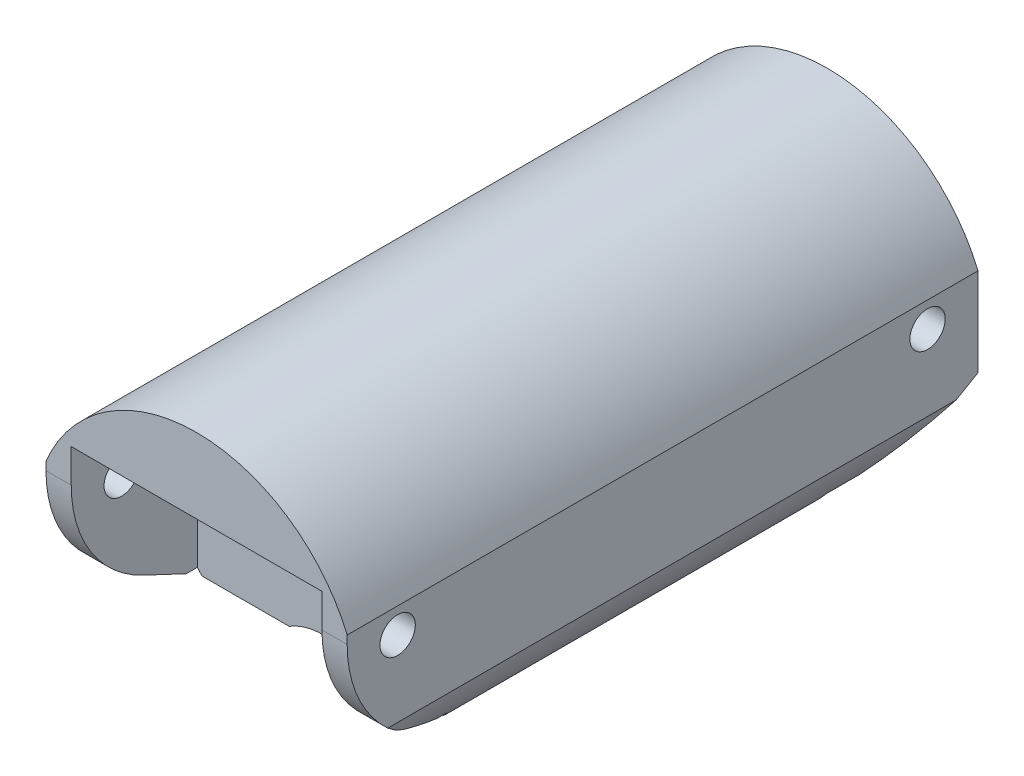
from build123d import *

# Parameters (mm, degrees)
BOSS_EXTRUDE1_DEPTH = 15.875
CUT_EXTRUDE1_DEPTH  = 25.170309552
CUT_EXTRUDE2_DEPTH  = 37.609435107
BOSS_EXTRUDE2_DEPTH = 15.15872
SKETCH6_W           = 12.61872
SKETCH6_H           = 6.35
CUT_EXTRUDE3_DEPTH  = 11.43
SKETCH7_R           = 0.889
CUT_EXTRUDE4_DEPTH  = 25.170309552
CUT_EXTRUDE5_DEPTH  = 15.875
FILLET1_R           = 6.35
CUT_EXTRUDE6_DEPTH  = 17.78
SKETCH10_W          = 0.284935898
SKETCH10_H          = 2.320192308
CUT_EXTRUDE7_DEPTH  = 1


with BuildPart() as part:
    # Sketch1 → Boss-Extrude1 (new, symmetric)
    with BuildSketch(Plane.XY):
        with BuildLine():
            Line((0, 0), (0, 5.08))
            ThreePointArc((0, 5.08), (7.57936, 10.11936), (15.15872, 5.08))
            Line((15.15872, 5.08), (15.15872, 0))
            ThreePointArc((15.15872, 0), (7.57936, -5.03936), (0, 0))
        make_face()
    extrude(amount=BOSS_EXTRUDE1_DEPTH, both=True)

    # Sketch2 → Cut-Extrude1 (cut, through all)
    with BuildSketch(Plane(origin=(0, 0, 0), x_dir=(0, 0, -1), z_dir=(1, 0, 0))):
        Polygon((-15.875, -5.03936), (-15.875, 0.635), (-3.81, -5.03936), align=None)
        Polygon((15.875, 0.635), (15.875, -5.03936), (6.04672018, -5.03936), align=None)
        with BuildLine():
            Line((-13.335, 1.27), (-15.875, 1.27))
            Line((-15.875, 1.27), (-15.875, 3.81))
            Line((-15.875, 3.81), (-13.335, 3.81))
            ThreePointArc((-13.335, 3.81), (-8.595295474, 2.54), (-13.335, 1.27))
        make_face()
        with BuildLine():
            Line((13.335, 1.27), (15.875, 1.27))
            Line((15.875, 1.27), (15.875, 3.81))
            Line((15.875, 3.81), (13.335, 3.81))
            ThreePointArc((13.335, 3.81), (8.595295474, 2.54), (13.335, 1.27))
        make_face()
    extrude(amount=CUT_EXTRUDE1_DEPTH, mode=Mode.SUBTRACT)

    # Sketch3 → Cut-Extrude2 (cut, through all)
    with BuildSketch(Plane.XY.offset(15.875)):
        with BuildLine():
            ThreePointArc((4.953709685, -3.254259045), (7.57936, -3.76936), (10.205010315, -3.254259045))
            ThreePointArc((10.205010315, -3.254259045), (7.57936, -1.86436), (4.953709685, -3.254259045))
        make_face()
    extrude(amount=-CUT_EXTRUDE2_DEPTH, mode=Mode.SUBTRACT)

    # Sketch4 → Boss-Extrude2 (add)
    with BuildSketch(Plane.ZY):
        with BuildLine():
            Line((15.875, 1.27), (13.335, 1.27))
            ThreePointArc((13.335, 1.27), (12.405295474, 0.340295474), (11.135295474, 0))
            ThreePointArc((11.135295474, 0), (8.595295474, 2.54), (11.135295474, 5.08))
            ThreePointArc((11.135295474, 5.08), (12.405295474, 4.739704526), (13.335, 3.81))
            Line((13.335, 3.81), (15.875, 3.81))
            Line((15.875, 3.81), (15.875, 1.27))
        make_face()
        with BuildLine():
            Line((-13.335, 1.27), (-15.875, 1.27))
            Line((-15.875, 1.27), (-15.875, 3.81))
            Line((-15.875, 3.81), (-13.335, 3.81))
            ThreePointArc((-13.335, 3.81), (-12.405295474, 4.739704526), (-11.135295474, 5.08))
            ThreePointArc((-11.135295474, 5.08), (-8.595295474, 2.54), (-11.135295474, 0))
            ThreePointArc((-11.135295474, 0), (-12.405295474, 0.340295474), (-13.335, 1.27))
        make_face()
    extrude(amount=-BOSS_EXTRUDE2_DEPTH)

    # Sketch6 → Cut-Extrude3 (cut)
    with BuildSketch(Plane(origin=(0, -5.08, 0), x_dir=(1, 0, 0), z_dir=(0, 1, 0))):
        with Locations((7.57936, -12.7)):
            Rectangle(SKETCH6_W, SKETCH6_H)
        with Locations((7.57936, 12.7)):
            Rectangle(SKETCH6_W, SKETCH6_H)
    extrude(amount=CUT_EXTRUDE3_DEPTH, mode=Mode.SUBTRACT)

    # Sketch7 → Cut-Extrude4 (cut, through all)
    with BuildSketch(Plane.ZY):
        with Locations((13.335, 3.81)):
            Circle(SKETCH7_R)
        with Locations(Location((-13.335, 3.81, 0), (0, 0, 180))):
            Circle(SKETCH7_R)
    extrude(amount=-CUT_EXTRUDE4_DEPTH, mode=Mode.SUBTRACT)

    # Sketch8 → Cut-Extrude5 (cut)
    with BuildSketch(Plane(origin=(0, 0, -9.525), x_dir=(-1, 0, 0), z_dir=(0, 0, -1))):
        with BuildLine():
            Line((-4.91236, 6.23824), (-5.54736, 6.23824))
            ThreePointArc((-5.54736, 6.23824), (-5.92836, 5.85724), (-5.54736, 5.47624))
            Line((-5.54736, 5.47624), (-4.91236, 5.47624))
            ThreePointArc((-4.91236, 5.47624), (-4.53136, 5.85724), (-4.91236, 6.23824))
        make_face()
    extrude(amount=-CUT_EXTRUDE5_DEPTH, mode=Mode.SUBTRACT)

    # Fillet1
    fillet1_edges = [part.edges().sort_by_distance(p)[0] for p in [
        (0.635, 0.635, 15.875),
        (14.52372, 0.635, 15.875),
    ]]
    fillet(fillet1_edges, radius=FILLET1_R)

    # Sketch9 → Cut-Extrude6 (cut)
    with BuildSketch(Plane.XY.offset(9.525)):
        with BuildLine():
            Line((9.61136, 6.767094737), (10.24636, 6.767094737))
            ThreePointArc((10.24636, 6.767094737), (10.62736, 6.386094737), (10.24636, 6.005094737))
            Line((10.24636, 6.005094737), (9.61136, 6.005094737))
            ThreePointArc((9.61136, 6.005094737), (9.23036, 6.386094737), (9.61136, 6.767094737))
        make_face()
    extrude(amount=-CUT_EXTRUDE6_DEPTH, mode=Mode.SUBTRACT)

    # Sketch10 → Cut-Extrude7 (cut)
    # profile 1 of 9: a face of its own
    with BuildSketch(Plane.ZY):
        with BuildLine():
            Line((-9.132963094, 3.918079484), (-8.510301836, 3.918079484))
            add(Edge.make_bspline(
                [(-8.510301836, 3.918079484), (-8.4674748, 3.918032407), (-8.385416296, 3.917942204), (-8.26774621, 3.915207399), (-8.160875953, 3.911554614), (-8.065035965, 3.90649104), (-7.979931362, 3.90050699), (-7.90594724, 3.892114069), (-7.842502071, 3.883350801), (-7.804486935, 3.874441382), (-7.787149793, 3.870378162)],
                knots=[0, 0, 0, 0, 1.415646017, 2.712440637, 3.8905458, 4.950247383, 5.884950622, 6.709939814, 7.411656543, 8, 8, 8, 8], degree=3))
            add(Edge.make_bspline(
                [(-7.787149793, 3.870378162), (-7.765202801, 3.864371107), (-7.721825972, 3.852498547), (-7.659322883, 3.828718955), (-7.59985618, 3.800522991), (-7.543221838, 3.768388417), (-7.490115805, 3.730936512), (-7.439745754, 3.689685445), (-7.3925562, 3.643682808), (-7.348812509, 3.593444565), (-7.308639871, 3.539814089), (-7.274050802, 3.48199078), (-7.245088246, 3.420947955), (-7.220247707, 3.356728073), (-7.202369323, 3.288791851), (-7.188901064, 3.217611333), (-7.180352488, 3.14319415), (-7.179533735, 3.092339841), (-7.17911694, 3.06645188)],
                knots=[0, 0, 0, 0, 0.999701418, 1.975846123, 2.934577507, 3.890451536, 4.834027766, 5.787354733, 6.749476667, 7.726910423, 8.712836071, 9.690891519, 10.682875813, 11.679750201, 12.712814741, 13.765529915, 14.8625177, 16, 16, 16, 16], degree=3))
            add(Edge.make_bspline(
                [(-7.17911694, 3.06645188), (-7.179499233, 3.040346325), (-7.180247213, 2.989269044), (-7.189224558, 2.914545158), (-7.201316946, 2.843136333), (-7.219910701, 2.775200902), (-7.244263561, 2.711142311), (-7.272831352, 2.649981622), (-7.30728784, 2.592759348), (-7.346879936, 2.539267748), (-7.390923168, 2.489456614), (-7.43923119, 2.443686907), (-7.491608977, 2.402226543), (-7.547890069, 2.364982574), (-7.608623146, 2.332818663), (-7.672887099, 2.304010251), (-7.74124051, 2.279815789), (-7.788541219, 2.267088519), (-7.812590498, 2.260617545)],
                knots=[0, 0, 0, 0, 1.121902311, 2.195077645, 3.232258892, 4.234102512, 5.217864754, 6.176164875, 7.132989551, 8.084763148, 9.034132444, 9.988522005, 10.94243251, 11.903244335, 12.886203696, 13.894208494, 14.929344452, 16, 16, 16, 16], degree=3))
            add(Edge.make_bspline(
                [(-7.812590498, 2.260617545), (-7.832481722, 2.256387555), (-7.876074497, 2.247117286), (-7.947868252, 2.236768186), (-8.031457281, 2.227934791), (-8.126727492, 2.221311616), (-8.23359337, 2.215641639), (-8.352112725, 2.211134868), (-8.482518209, 2.208658501), (-8.573478552, 2.208530781), (-8.620968903, 2.208464099)],
                knots=[0, 0, 0, 0, 0.601384939, 1.31797006, 2.144135048, 3.087295005, 4.142315834, 5.309527816, 6.595305764, 8, 8, 8, 8], degree=3))
            Line((-8.620968903, 2.208464099), (-8.848027196, 2.208464099))
            Line((-8.848027196, 2.208464099), (-8.848027196, 0.743079484))
            Line((-8.848027196, 0.743079484), (-9.132963094, 0.743079484))
            Line((-9.132963094, 0.743079484), (-9.132963094, 3.918079484))
        make_face()
        with BuildLine():
            Line((-8.848027196, 3.592438458), (-8.848027196, 2.534105125))
            Line((-8.848027196, 2.534105125), (-8.292147789, 2.527108931))
            add(Edge.make_bspline(
                [(-8.292147789, 2.527108931), (-8.265006142, 2.527094903), (-8.212609753, 2.527067823), (-8.136921179, 2.53068299), (-8.066699897, 2.534856331), (-8.002161603, 2.540966775), (-7.943277205, 2.549603916), (-7.889948519, 2.558323136), (-7.842589055, 2.570937286), (-7.78716335, 2.587921784), (-7.725402028, 2.616889229), (-7.65821218, 2.6589352), (-7.601270291, 2.712529843), (-7.551995836, 2.772789375), (-7.512892647, 2.839826443), (-7.484266854, 2.911553264), (-7.467447376, 2.987234242), (-7.465192043, 3.039021339), (-7.464052838, 3.065179845)],
                knots=[0, 0, 0, 0, 1.160613943, 2.240541288, 3.23993089, 4.169200891, 5.011653406, 5.7853311, 6.478053781, 7.106038997, 8.262395093, 9.384106736, 10.481365981, 11.59014053, 12.70357646, 13.786202915, 14.881775077, 16, 16, 16, 16], degree=3))
            add(Edge.make_bspline(
                [(-7.464052838, 3.065179845), (-7.465198238, 3.090705496), (-7.467475153, 3.141447332), (-7.484398686, 3.215813779), (-7.512836992, 3.28678474), (-7.552258332, 3.352981753), (-7.600102071, 3.413024453), (-7.655709332, 3.465182562), (-7.718949219, 3.507112249), (-7.777775829, 3.534175297), (-7.830028333, 3.550699154), (-7.875414468, 3.562260545), (-7.92665958, 3.571491274), (-7.983780352, 3.57896568), (-8.046334051, 3.585364177), (-8.114858094, 3.589705742), (-8.189092899, 3.592247063), (-8.240628202, 3.592373115), (-8.267343102, 3.592438458)],
                knots=[0, 0, 0, 0, 1.120700087, 2.227813068, 3.331159281, 4.466773991, 5.599788987, 6.693661531, 7.80175334, 8.91857717, 9.525282508, 10.207424825, 10.974604443, 11.810962634, 12.737642355, 13.736264703, 14.826523623, 16, 16, 16, 16], degree=3))
            Line((-8.267343102, 3.592438458), (-8.848027196, 3.592438458))
        make_face(mode=Mode.SUBTRACT)
    # profile 2 of 9: a face of its own
    with BuildSketch(Plane.ZY):
        with BuildLine():
            add(Edge.make_bspline(
                [(-5.488582084, 3.10397692), (-5.445047144, 3.103049919), (-5.359685765, 3.101232296), (-5.234674326, 3.081805863), (-5.115344095, 3.052099325), (-5.00123805, 3.011031551), (-4.893817553, 2.955984353), (-4.791517925, 2.890298782), (-4.694619638, 2.812481714), (-4.636541604, 2.752285467), (-4.607061652, 2.721730325)],
                knots=[0, 0, 0, 0, 1.054011418, 2.066658804, 3.057071809, 4.030435133, 4.997543892, 5.974964718, 6.972108034, 8, 8, 8, 8], degree=3))
            add(Edge.make_bspline(
                [(-4.607061652, 2.721730325), (-4.581678022, 2.692507638), (-4.531402005, 2.634627803), (-4.466935246, 2.540778783), (-4.411398545, 2.443587406), (-4.366891431, 2.341763046), (-4.331798588, 2.236194594), (-4.306883278, 2.126519198), (-4.292063344, 2.012979069), (-4.290064938, 1.935868444), (-4.289052838, 1.896815462)],
                knots=[0, 0, 0, 0, 1.025258237, 2.030674902, 3.01204498, 3.988269485, 4.97094183, 5.956517959, 6.965070386, 8, 8, 8, 8], degree=3))
            add(Edge.make_bspline(
                [(-4.289052838, 1.896815462), (-4.289943051, 1.857536124), (-4.291702153, 1.77991832), (-4.308342434, 1.665600752), (-4.334224205, 1.554752592), (-4.371264515, 1.447837919), (-4.4187608, 1.344529926), (-4.476718781, 1.245279835), (-4.545545176, 1.149891828), (-4.623563088, 1.059175875), (-4.709788718, 0.975567952), (-4.803329795, 0.902698736), (-4.902348098, 0.840267781), (-5.008160282, 0.789979033), (-5.119800074, 0.75032809), (-5.237508271, 0.72247879), (-5.361102014, 0.705640691), (-5.445490993, 0.70347845), (-5.488582084, 0.702374356)],
                knots=[0, 0, 0, 0, 0.998656419, 1.973391657, 2.932242238, 3.890759089, 4.846373663, 5.82037756, 6.809684879, 7.83454468, 8.860553229, 9.859544525, 10.845671541, 11.83227036, 12.833544569, 13.85385346, 14.904124723, 16, 16, 16, 16], degree=3))
            add(Edge.make_bspline(
                [(-5.488582084, 0.702374356), (-5.531884294, 0.703482155), (-5.61669386, 0.705651836), (-5.740723858, 0.722413371), (-5.858643012, 0.750315256), (-5.970428955, 0.790109338), (-6.076696066, 0.840269389), (-6.176288103, 0.902509993), (-6.269905169, 0.975589562), (-6.35614904, 1.059170019), (-6.434162061, 1.149893337), (-6.502989719, 1.245279443), (-6.560947372, 1.344530028), (-6.608443742, 1.447837892), (-6.64548403, 1.554752599), (-6.671365807, 1.66560075), (-6.688006085, 1.77991832), (-6.689765188, 1.857536124), (-6.690655402, 1.896815462)],
                knots=[0, 0, 0, 0, 1.099876186, 2.154163076, 3.173186993, 4.173200201, 5.163417411, 6.152872554, 7.150605724, 8.17532212, 9.198891216, 10.186952605, 11.159729845, 12.11414092, 13.071450619, 14.029093627, 15.002601286, 16, 16, 16, 16], degree=3))
            add(Edge.make_bspline(
                [(-6.690655402, 1.896815462), (-6.689636399, 1.935656185), (-6.687618948, 2.012554143), (-6.672813915, 2.125880834), (-6.647995796, 2.235370608), (-6.612860886, 2.340531576), (-6.567943534, 2.441909721), (-6.513187223, 2.539341247), (-6.448062863, 2.632765894), (-6.397986807, 2.690570924), (-6.372646588, 2.719822272)],
                knots=[0, 0, 0, 0, 1.031353054, 2.041901799, 3.029428768, 4.008703097, 4.981709435, 5.96992636, 6.972712378, 8, 8, 8, 8], degree=3))
            add(Edge.make_bspline(
                [(-6.372646588, 2.719822272), (-6.34321108, 2.750642396), (-6.285320975, 2.811255592), (-6.187940343, 2.88884581), (-6.085892377, 2.955898248), (-5.977284765, 3.009851672), (-5.863272459, 3.052340899), (-5.743330717, 3.081882474), (-5.617895071, 3.101162303), (-5.532115986, 3.103029364), (-5.488582084, 3.10397692)],
                knots=[0, 0, 0, 0, 1.027980169, 2.021703884, 2.998553061, 3.971491411, 4.943284454, 5.930300938, 6.949603206, 8, 8, 8, 8], degree=3))
        make_face()
        with BuildLine():
            add(Edge.make_bspline(
                [(-5.48985412, 2.819041022), (-5.520640381, 2.818166), (-5.581418162, 2.816438544), (-5.670880214, 2.803299573), (-5.757004497, 2.782482909), (-5.839954405, 2.752906372), (-5.919450212, 2.714716656), (-5.995568027, 2.667809787), (-6.06853174, 2.612807033), (-6.13691404, 2.549794467), (-6.199672281, 2.480961379), (-6.254534445, 2.407620368), (-6.301184363, 2.330961039), (-6.340046507, 2.250903676), (-6.368990885, 2.166636987), (-6.390012127, 2.079115271), (-6.403138702, 1.988160215), (-6.404849917, 1.926328434), (-6.405719504, 1.894907409)],
                knots=[0, 0, 0, 0, 1.021534396, 2.016698045, 2.994645724, 3.958388632, 4.93408049, 5.916473867, 6.921342795, 7.962252576, 8.998418191, 10.008913653, 10.997312074, 11.973003931, 12.956656626, 13.948281152, 14.957379055, 16, 16, 16, 16], degree=3))
            add(Edge.make_bspline(
                [(-6.405719504, 1.894907409), (-6.404261886, 1.854310927), (-6.401368785, 1.773734502), (-6.377841821, 1.655070126), (-6.338484267, 1.541149446), (-6.285337235, 1.432640296), (-6.218747308, 1.332244729), (-6.140291183, 1.242735597), (-6.050810883, 1.165459897), (-5.951373058, 1.101342273), (-5.844008784, 1.050397351), (-5.730383407, 1.014293995), (-5.611873635, 0.990824674), (-5.530883257, 0.988491979), (-5.48985412, 0.987310253)],
                knots=[0, 0, 0, 0, 1.016792936, 2.018143844, 3.017858371, 4.030088057, 5.03801393, 6.028138512, 7.003788237, 7.991172063, 8.984598303, 9.972568034, 10.972917682, 12, 12, 12, 12], degree=3))
            add(Edge.make_bspline(
                [(-5.48985412, 0.987310253), (-5.448827342, 0.988498865), (-5.367841623, 0.99084515), (-5.249496512, 1.014175794), (-5.136181695, 1.050555543), (-5.028928936, 1.101284977), (-4.929536375, 1.165703381), (-4.839412529, 1.242299238), (-4.761626289, 1.332481803), (-4.695102233, 1.432773276), (-4.641084831, 1.540981224), (-4.601911498, 1.655091152), (-4.578327973, 1.773729147), (-4.575442507, 1.854309133), (-4.573988735, 1.894907409)],
                knots=[0, 0, 0, 0, 1.02726834, 2.027799167, 3.010890988, 4.004497153, 4.992059811, 5.971914811, 6.958719428, 7.966827853, 8.981595046, 9.981490638, 10.983022906, 12, 12, 12, 12], degree=3))
            add(Edge.make_bspline(
                [(-4.573988735, 1.894907409), (-4.574858023, 1.926328622), (-4.576568648, 1.988160772), (-4.589699509, 2.079113141), (-4.610704891, 2.166644803), (-4.639707716, 2.250874835), (-4.678401, 2.331168321), (-4.725950519, 2.407395288), (-4.780588664, 2.48121544), (-4.844104195, 2.549571957), (-4.912415116, 2.612831598), (-4.985408401, 2.667831115), (-5.061413345, 2.714510505), (-5.140678203, 2.753233023), (-5.223638746, 2.782213825), (-5.309642356, 2.803419769), (-5.398722705, 2.816383019), (-5.459282694, 2.818149355), (-5.48985412, 2.819041022)],
                knots=[0, 0, 0, 0, 1.042956736, 2.052379634, 3.044323526, 4.02829302, 5.004299113, 5.996692471, 7.007513377, 8.048758398, 9.090003419, 10.095195979, 11.07790575, 12.047570684, 13.018257071, 13.989683339, 14.985167495, 16, 16, 16, 16], degree=3))
        make_face(mode=Mode.SUBTRACT)
    # profile 3 of 9: a face of its own
    with BuildSketch(Plane.ZY):
        with BuildLine():
            add(Edge.make_bspline(
                [(-3.618690257, 4.040194869), (-3.601008849, 4.039374673), (-3.566385257, 4.037768573), (-3.516317078, 4.024014947), (-3.470726789, 4.000701661), (-3.430288417, 3.969423665), (-3.395588491, 3.932639527), (-3.371294561, 3.889767077), (-3.355680459, 3.843449598), (-3.353794912, 3.811141624), (-3.352834889, 3.794692064)],
                knots=[0, 0, 0, 0, 1.055194115, 2.066272739, 3.074728998, 4.095836921, 5.109056067, 6.073838105, 7.019297344, 8, 8, 8, 8], degree=3))
            add(Edge.make_bspline(
                [(-3.352834889, 3.794692064), (-3.353816562, 3.778669514), (-3.355757215, 3.74699483), (-3.371282501, 3.701480323), (-3.395795531, 3.65920358), (-3.430266166, 3.622490865), (-3.470732685, 3.591230159), (-3.516315512, 3.567912289), (-3.566385669, 3.554159879), (-3.601008989, 3.552553611), (-3.618690257, 3.55173333)],
                knots=[0, 0, 0, 0, 0.96129708, 1.900370562, 2.859976407, 3.87933698, 4.906634145, 5.921202961, 6.938410037, 8, 8, 8, 8], degree=3))
            add(Edge.make_bspline(
                [(-3.618690257, 3.55173333), (-3.636169336, 3.552522291), (-3.670190078, 3.554057899), (-3.71950857, 3.56818213), (-3.764710129, 3.591238139), (-3.805227367, 3.622286178), (-3.839000471, 3.659429049), (-3.863582523, 3.701454523), (-3.879071953, 3.747001399), (-3.881017438, 3.778671721), (-3.882001555, 3.794692064)],
                knots=[0, 0, 0, 0, 1.054934014, 2.053291228, 3.073705704, 4.106921865, 5.123545215, 6.088680038, 7.033164197, 8, 8, 8, 8], degree=3))
            add(Edge.make_bspline(
                [(-3.882001555, 3.794692064), (-3.881038998, 3.811139335), (-3.879148475, 3.843442812), (-3.863570913, 3.889793306), (-3.83920523, 3.93241224), (-3.805205005, 3.969628229), (-3.76471608, 4.00069373), (-3.719507033, 4.023745121), (-3.670190484, 4.03787055), (-3.636169473, 4.039405993), (-3.618690257, 4.040194869)],
                knots=[0, 0, 0, 0, 0.98631895, 1.937192651, 2.907499808, 3.917963147, 4.944918757, 5.95915025, 6.951458133, 8, 8, 8, 8], degree=3))
        make_face()
    # profile 4 of 9: a face of its own
    with BuildSketch(Plane.ZY):
        with Locations((-3.617418222, 1.903175638)):
            Rectangle(SKETCH10_W, SKETCH10_H)
    # profile 5 of 9: a face of its own
    with BuildSketch(Plane.ZY):
        with BuildLine():
            Line((-2.782963094, 3.063271792), (-2.498027196, 3.063271792))
            Line((-2.498027196, 3.063271792), (-2.498027196, 2.644772192))
            add(Edge.make_bspline(
                [(-2.498027196, 2.644772192), (-2.46760377, 2.682729519), (-2.40856605, 2.756387037), (-2.310245977, 2.853197844), (-2.206338296, 2.932976727), (-2.097479335, 2.996570883), (-1.983521319, 3.044510322), (-1.865158888, 3.079132274), (-1.741683405, 3.099892083), (-1.657714237, 3.102604649), (-1.615234729, 3.10397692)],
                knots=[0, 0, 0, 0, 1.12780773, 2.188550248, 3.19190651, 4.159438251, 5.104880172, 6.052711206, 7.014878035, 8, 8, 8, 8], degree=3))
            add(Edge.make_bspline(
                [(-1.615234729, 3.10397692), (-1.572299082, 3.102393778), (-1.488263665, 3.099295188), (-1.365909995, 3.07478719), (-1.25163413, 3.032926851), (-1.145843533, 2.975584473), (-1.050478133, 2.904277172), (-0.966726303, 2.821203042), (-0.897453929, 2.725648166), (-0.851010607, 2.636999303), (-0.820416626, 2.558360183), (-0.801155863, 2.491007774), (-0.784799187, 2.415970594), (-0.770618958, 2.333475395), (-0.761024007, 2.24294418), (-0.753456357, 2.144748059), (-0.748032827, 2.03891884), (-0.747817646, 1.965724543), (-0.747706684, 1.927980325)],
                knots=[0, 0, 0, 0, 1.235846778, 2.418850247, 3.575807741, 4.728682307, 5.871620074, 6.994088408, 8.11269785, 9.256955736, 9.865816715, 10.540099792, 11.271859618, 12.076849838, 12.949306005, 13.892391288, 14.913166135, 16, 16, 16, 16], degree=3))
            Line((-0.747706684, 1.927980325), (-0.747706684, 0.743079484))
            Line((-0.747706684, 0.743079484), (-1.032642581, 0.743079484))
            Line((-1.032642581, 0.743079484), (-1.032642581, 1.834485734))
            add(Edge.make_bspline(
                [(-1.032642581, 1.834485734), (-1.032817848, 1.866074666), (-1.033153105, 1.926498917), (-1.034210513, 2.013012246), (-1.036759409, 2.091467927), (-1.040341093, 2.161678396), (-1.045583499, 2.223576234), (-1.051046886, 2.277287506), (-1.057727972, 2.32274402), (-1.063681472, 2.350108059), (-1.066351515, 2.362380365)],
                knots=[0, 0, 0, 0, 1.430800155, 2.736877192, 3.918605307, 4.986035426, 5.920637409, 6.731861385, 7.431261377, 8, 8, 8, 8], degree=3))
            add(Edge.make_bspline(
                [(-1.066351515, 2.362380365), (-1.07599039, 2.398404083), (-1.094542243, 2.467738594), (-1.140383784, 2.561786043), (-1.198272363, 2.641794399), (-1.26893684, 2.707268996), (-1.351694645, 2.75822397), (-1.446316124, 2.793578914), (-1.551888177, 2.815691673), (-1.626141795, 2.817893428), (-1.664844104, 2.819041022)],
                knots=[0, 0, 0, 0, 1.084156227, 2.086665306, 3.027808233, 3.945421172, 4.874247719, 5.839848303, 6.874090471, 8, 8, 8, 8], degree=3))
            add(Edge.make_bspline(
                [(-1.664844104, 2.819041022), (-1.687765502, 2.818609218), (-1.733126358, 2.817754689), (-1.800390975, 2.809181011), (-1.865636475, 2.795157984), (-1.929517665, 2.776227148), (-1.990756878, 2.750226375), (-2.051321628, 2.72071759), (-2.108931335, 2.683934569), (-2.164814417, 2.642940219), (-2.216805321, 2.597511224), (-2.265181742, 2.549573704), (-2.308305518, 2.498523692), (-2.347374959, 2.44518374), (-2.381100955, 2.388821287), (-2.410540542, 2.329980095), (-2.435519351, 2.268582717), (-2.447931508, 2.225969625), (-2.45414198, 2.204647994)],
                knots=[0, 0, 0, 0, 1.023777757, 2.026029729, 3.023749952, 4.003683103, 4.997618607, 5.993177895, 7.010360494, 8.046726602, 9.087585522, 10.09234134, 11.086953743, 12.070360549, 13.043493632, 14.017870808, 15.008233677, 16, 16, 16, 16], degree=3))
            add(Edge.make_bspline(
                [(-2.45414198, 2.204647994), (-2.457715804, 2.188995059), (-2.465495832, 2.15491944), (-2.47389886, 2.098999146), (-2.481525732, 2.034310811), (-2.487909258, 1.960929924), (-2.491814886, 1.878599566), (-2.496073375, 1.787671341), (-2.497623737, 1.687782677), (-2.497888944, 1.61823957), (-2.498027196, 1.581986736)],
                knots=[0, 0, 0, 0, 0.615963638, 1.340920617, 2.168419149, 3.115676021, 4.16674242, 5.331190069, 6.6087489, 8, 8, 8, 8], degree=3))
            Line((-2.498027196, 1.581986736), (-2.498027196, 0.743079484))
            Line((-2.498027196, 0.743079484), (-2.782963094, 0.743079484))
            Line((-2.782963094, 0.743079484), (-2.782963094, 3.063271792))
        make_face()
    # profile 6 of 9: a face of its own
    with BuildSketch(Plane.ZY):
        Polygon((0.188511265, 3.99948974), (0.473447162, 3.99948974), (0.473447162, 3.063271792), (0.880498445, 3.063271792), (0.880498445, 2.778335894), (0.473447162, 2.778335894), (0.473447162, 0.743079484), (0.188511265, 0.743079484), (0.188511265, 2.778335894), (-0.218540017, 2.778335894), (-0.218540017, 3.063271792), (0.188511265, 3.063271792), align=None)
    # profile 7 of 9: a face of its own
    with BuildSketch(Plane.ZY):
        with BuildLine():
            Line((3.273196762, 1.475771792), (3.526331778, 1.342844107))
            add(Edge.make_bspline(
                [(3.526331778, 1.342844107), (3.506160009, 1.307063371), (3.466913736, 1.237448228), (3.399421629, 1.141806469), (3.328671677, 1.055766041), (3.251470221, 0.981625569), (3.170127012, 0.916990384), (3.084190961, 0.860441071), (2.993214676, 0.812254985), (2.897193854, 0.771658049), (2.795322119, 0.740443722), (2.6873526, 0.718396322), (2.573078458, 0.704768071), (2.494750138, 0.703184979), (2.454642074, 0.702374356)],
                knots=[0, 0, 0, 0, 1.120438281, 2.179929193, 3.190490725, 4.156257408, 5.095198341, 6.022838206, 6.959905092, 7.901321166, 8.864066838, 9.862729781, 10.905609505, 12, 12, 12, 12], degree=3))
            add(Edge.make_bspline(
                [(2.454642074, 0.702374356), (2.41006328, 0.703415008), (2.323102968, 0.705445018), (2.196520483, 0.722946039), (2.077340582, 0.751495965), (1.965569966, 0.791378992), (1.861482351, 0.843473779), (1.764870861, 0.906937023), (1.675227434, 0.981442711), (1.595376901, 1.067636199), (1.523491379, 1.15987626), (1.460058671, 1.255993384), (1.40702943, 1.355745738), (1.363892419, 1.458498284), (1.32905372, 1.563603388), (1.304772496, 1.672017362), (1.290775511, 1.783446785), (1.288630621, 1.858827939), (1.287549727, 1.896815462)],
                knots=[0, 0, 0, 0, 1.145258523, 2.234067595, 3.276747158, 4.290159414, 5.277019952, 6.260822364, 7.254936242, 8.264827045, 9.274100331, 10.257902744, 11.220704747, 12.172965371, 13.118907548, 14.062713208, 15.023725156, 16, 16, 16, 16], degree=3))
            add(Edge.make_bspline(
                [(1.287549727, 1.896815462), (1.288510519, 1.932461486), (1.290414683, 2.0031072), (1.302416897, 2.107669515), (1.323687849, 2.209295326), (1.352876371, 2.308069075), (1.390569287, 2.403825382), (1.436681372, 2.496622526), (1.491284458, 2.58636176), (1.533441812, 2.642970317), (1.55467713, 2.671484933)],
                knots=[0, 0, 0, 0, 1.024358464, 2.0301432, 3.019427413, 4.004406732, 4.986367066, 5.972626655, 6.978780325, 8, 8, 8, 8], degree=3))
            add(Edge.make_bspline(
                [(1.55467713, 2.671484933), (1.583440528, 2.705837408), (1.640056173, 2.773454158), (1.735810867, 2.862298211), (1.839497473, 2.936723636), (1.949816591, 2.998415824), (2.068050393, 3.045291203), (2.192609535, 3.080223081), (2.324912317, 3.09979742), (2.415359196, 3.102562241), (2.461638268, 3.10397692)],
                knots=[0, 0, 0, 0, 1.030682036, 2.02871468, 2.997146059, 3.962720338, 4.930598197, 5.918074684, 6.934738563, 8, 8, 8, 8], degree=3))
            add(Edge.make_bspline(
                [(2.461638268, 3.10397692), (2.509215739, 3.102748604), (2.60255189, 3.100338929), (2.738652457, 3.077999326), (2.867431107, 3.04257308), (2.988836308, 2.992540713), (3.102880367, 2.927988834), (3.208821998, 2.848031592), (3.308473013, 2.755123756), (3.366447224, 2.683674273), (3.395948164, 2.647316263)],
                knots=[0, 0, 0, 0, 1.056321875, 2.072262726, 3.055038591, 4.01806755, 4.982017516, 5.957941055, 6.960871419, 8, 8, 8, 8], degree=3))
            add(Edge.make_bspline(
                [(3.395948164, 2.647316263), (3.416020458, 2.6199173), (3.456031439, 2.565301749), (3.506148451, 2.476246485), (3.549652659, 2.383073303), (3.584426131, 2.284276105), (3.612583393, 2.181025486), (3.632954936, 2.07258332), (3.644901661, 1.958981901), (3.64724998, 1.881578526), (3.648447162, 1.842117946)],
                knots=[0, 0, 0, 0, 0.94817472, 1.890038105, 2.849395472, 3.817997239, 4.812318967, 5.836947057, 6.897266129, 8, 8, 8, 8], degree=3))
            Line((3.648447162, 1.842117946), (1.572485624, 1.842117946))
            add(Edge.make_bspline(
                [(1.572485624, 1.842117946), (1.573882267, 1.81154681), (1.576628709, 1.751429905), (1.58943316, 1.663463552), (1.609615977, 1.579667735), (1.637981483, 1.500670975), (1.672332122, 1.425441502), (1.714410593, 1.354537369), (1.764611474, 1.288281532), (1.820605502, 1.226081343), (1.882932652, 1.17069051), (1.94850343, 1.121113541), (2.018256879, 1.079561321), (2.091642997, 1.04583385), (2.168543116, 1.019430263), (2.248981465, 1.001407312), (2.332799756, 0.989335865), (2.389936815, 0.987993597), (2.419025087, 0.987310253)],
                knots=[0, 0, 0, 0, 1.094153842, 2.151609401, 3.174256925, 4.172055639, 5.149267565, 6.128595816, 7.11444997, 8.118368179, 9.117203808, 10.09244225, 11.054858984, 12.015122123, 12.976791628, 13.957293641, 14.960065497, 16, 16, 16, 16], degree=3))
            add(Edge.make_bspline(
                [(2.419025087, 0.987310253), (2.447465057, 0.987861847), (2.503895412, 0.988956316), (2.587933904, 0.999598835), (2.670610475, 1.016807585), (2.751582939, 1.040293505), (2.82920792, 1.068938221), (2.901094955, 1.103502956), (2.967207722, 1.141738798), (3.028999542, 1.18547186), (3.088935372, 1.239000715), (3.14839177, 1.305798834), (3.212142734, 1.384799663), (3.252047579, 1.444258945), (3.273196762, 1.475771792)],
                knots=[0, 0, 0, 0, 0.99110716, 1.966546729, 2.947904876, 3.932708344, 4.903319531, 5.828989031, 6.710028674, 7.56322171, 8.463672341, 9.504779593, 10.677557249, 12, 12, 12, 12], degree=3))
        make_face()
        with BuildLine():
            add(Edge.make_bspline(
                [(3.363511265, 2.127053843), (3.353082184, 2.164848021), (3.333009561, 2.237589648), (3.291066573, 2.338319599), (3.243830247, 2.427843624), (3.187930533, 2.505476576), (3.124594975, 2.57442262), (3.051438274, 2.634673765), (2.969399999, 2.688573882), (2.878904207, 2.734069363), (2.783072016, 2.772795164), (2.682736399, 2.798762233), (2.580358263, 2.816550889), (2.51111216, 2.818207431), (2.476266674, 2.819041022)],
                knots=[0, 0, 0, 0, 1.154881502, 2.222775134, 3.210006277, 4.132804581, 5.035138423, 5.962687519, 6.919655026, 7.923214229, 8.944639381, 9.960483929, 10.97369054, 12, 12, 12, 12], degree=3))
            add(Edge.make_bspline(
                [(2.476266674, 2.819041022), (2.447828254, 2.818486149), (2.391611479, 2.817389281), (2.308788367, 2.806984235), (2.229250354, 2.789784947), (2.152410557, 2.766231022), (2.079275913, 2.734836076), (2.008342087, 2.698021291), (1.941412728, 2.653079998), (1.899555981, 2.618827322), (1.878410103, 2.601522994)],
                knots=[0, 0, 0, 0, 1.04873581, 2.073130211, 3.073294108, 4.04793562, 5.032784715, 6.005352987, 6.992311501, 8, 8, 8, 8], degree=3))
            add(Edge.make_bspline(
                [(1.878410103, 2.601522994), (1.863266912, 2.587830293), (1.832620783, 2.560119604), (1.791671881, 2.512377395), (1.752464738, 2.460895621), (1.716783496, 2.403704687), (1.684055971, 2.341455837), (1.653430849, 2.274674125), (1.625866032, 2.202852786), (1.610357418, 2.152803501), (1.602378453, 2.127053843)],
                knots=[0, 0, 0, 0, 0.879870761, 1.780643979, 2.707998968, 3.669668524, 4.684282772, 5.740141944, 6.837334558, 8, 8, 8, 8], degree=3))
            Line((1.602378453, 2.127053843), (3.363511265, 2.127053843))
        make_face(mode=Mode.SUBTRACT)
    # profile 8 of 9: a face of its own
    with BuildSketch(Plane.ZY):
        with BuildLine():
            Line((4.136908701, 3.063271792), (4.421844598, 3.063271792))
            Line((4.421844598, 3.063271792), (4.421844598, 2.721730325))
            add(Edge.make_bspline(
                [(4.421844598, 2.721730325), (4.442880115, 2.75353097), (4.483110378, 2.814349455), (4.549978535, 2.894785178), (4.618470843, 2.961383113), (4.688915191, 3.014454162), (4.761829611, 3.05419892), (4.835613845, 3.083311887), (4.911428736, 3.100527023), (4.962375624, 3.102825414), (4.987900287, 3.10397692)],
                knots=[0, 0, 0, 0, 1.2804753, 2.448899062, 3.506932113, 4.484331642, 5.4025378, 6.288909075, 7.142734305, 8, 8, 8, 8], degree=3))
            add(Edge.make_bspline(
                [(4.987900287, 3.10397692), (5.007699884, 3.102896942), (5.04843884, 3.100674818), (5.11010876, 3.085062141), (5.173648177, 3.060135649), (5.214598772, 3.036694876), (5.235947162, 3.024474716)],
                knots=[0, 0, 0, 0, 0.901110191, 1.854092781, 2.881294221, 4, 4, 4, 4], degree=3))
            Line((5.235947162, 3.024474716), (5.079486826, 2.777699877))
            add(Edge.make_bspline(
                [(5.079486826, 2.777699877), (5.065780785, 2.783814261), (5.039764096, 2.795420533), (5.001705311, 2.809156499), (4.966615813, 2.817244508), (4.944260585, 2.818469802), (4.933838789, 2.819041022)],
                knots=[0, 0, 0, 0, 1.180555205, 2.24091978, 3.179933427, 4, 4, 4, 4], degree=3))
            add(Edge.make_bspline(
                [(4.933838789, 2.819041022), (4.910973588, 2.817516989), (4.864335206, 2.814408401), (4.795859981, 2.789971054), (4.729414302, 2.750487443), (4.676644294, 2.706698649), (4.635784536, 2.664473147), (4.60662876, 2.627599239), (4.579883697, 2.586252909), (4.554329282, 2.541140982), (4.531046287, 2.491493193), (4.50931598, 2.437805563), (4.489668297, 2.380015911), (4.478464861, 2.339754625), (4.472726009, 2.319131167)],
                knots=[0, 0, 0, 0, 1.125678352, 2.296057538, 3.5422874, 4.923748041, 5.663163013, 6.437101912, 7.23742474, 8.08941207, 8.991984279, 9.93940061, 10.944477711, 12, 12, 12, 12], degree=3))
            add(Edge.make_bspline(
                [(4.472726009, 2.319131167), (4.468433052, 2.300736873), (4.458924479, 2.259994912), (4.449679298, 2.191643036), (4.440544807, 2.11088586), (4.43410716, 2.017498593), (4.428139936, 1.911714448), (4.424774361, 1.793372269), (4.42195937, 1.662350586), (4.421884016, 1.570752422), (4.421844598, 1.522837096)],
                knots=[0, 0, 0, 0, 0.566838948, 1.255505196, 2.06880316, 3.007127437, 4.065329342, 5.249902469, 6.561414163, 8, 8, 8, 8], degree=3))
            Line((4.421844598, 1.522837096), (4.421844598, 0.743079484))
            Line((4.421844598, 0.743079484), (4.136908701, 0.743079484))
            Line((4.136908701, 0.743079484), (4.136908701, 3.063271792))
        make_face()
    # profile 9 of 9: a face of its own
    with BuildSketch(Plane.ZY):
        with BuildLine():
            Line((6.945562547, 2.941156407), (6.66062665, 2.941156407))
            add(Edge.make_bspline(
                [(6.66062665, 2.941156407), (6.66248371, 2.978957855), (6.666130927, 3.053198893), (6.683210875, 3.161442723), (6.707650099, 3.264906719), (6.74220449, 3.362760141), (6.785118042, 3.455868202), (6.836580281, 3.543861073), (6.897534702, 3.62640308), (6.966665097, 3.702729031), (7.041748076, 3.772749184), (7.122761322, 3.833215012), (7.207892168, 3.884303185), (7.296882337, 3.927012597), (7.390735848, 3.959070886), (7.488601012, 3.982857659), (7.5909078, 3.997169058), (7.660612677, 3.998707378), (7.696063348, 3.99948974)],
                knots=[0, 0, 0, 0, 1.10065271, 2.161652631, 3.183658789, 4.190468796, 5.17591951, 6.163126047, 7.15150782, 8.156236427, 9.156009102, 10.134482811, 11.092018607, 12.041330605, 13.001268258, 13.972401359, 14.968799086, 16, 16, 16, 16], degree=3))
            add(Edge.make_bspline(
                [(7.696063348, 3.99948974), (7.730877744, 3.998674712), (7.799286788, 3.99707321), (7.899128759, 3.983319991), (7.994176733, 3.961779347), (8.084244921, 3.931557505), (8.168614708, 3.890931632), (8.247919899, 3.842129579), (8.323104634, 3.785687303), (8.390783645, 3.71923563), (8.45293026, 3.648294895), (8.506544448, 3.57255944), (8.552457818, 3.494337159), (8.59072807, 3.413031576), (8.618900425, 3.327877143), (8.640289228, 3.240113609), (8.652379096, 3.148832531), (8.654234587, 3.087050155), (8.655177932, 3.05563958)],
                knots=[0, 0, 0, 0, 1.111607364, 2.184268762, 3.212621178, 4.221274766, 5.211760367, 6.196651075, 7.1921475, 8.207485113, 9.220403448, 10.201281604, 11.166441695, 12.114753415, 13.065576456, 14.026450734, 14.996634279, 16, 16, 16, 16], degree=3))
            add(Edge.make_bspline(
                [(8.655177932, 3.05563958), (8.6536419, 3.01141833), (8.650596793, 2.923751851), (8.624548751, 2.794924082), (8.583866559, 2.670107195), (8.534883243, 2.569652642), (8.485468954, 2.488705116), (8.440939572, 2.422058505), (8.388810779, 2.350298544), (8.328323856, 2.273665531), (8.260730036, 2.19155921), (8.185417074, 2.104029181), (8.101847915, 2.01197979), (8.043193418, 1.949109709), (8.012800127, 1.916532008)],
                knots=[0, 0, 0, 0, 1.184426356, 2.348067706, 3.509069118, 4.696110526, 5.333549288, 6.050745305, 6.844228056, 7.710549037, 8.667450064, 9.695053472, 10.805634456, 12, 12, 12, 12], degree=3))
            Line((8.012800127, 1.916532008), (7.21841411, 1.06872051))
            Line((7.21841411, 1.06872051), (8.69588306, 1.06872051))
            Line((8.69588306, 1.06872051), (8.69588306, 0.743079484))
            Line((8.69588306, 0.743079484), (6.538511265, 0.743079484))
            Line((6.538511265, 0.743079484), (7.769841393, 2.057091904))
            add(Edge.make_bspline(
                [(7.769841393, 2.057091904), (7.799820548, 2.088386796), (7.857404368, 2.14849788), (7.938849991, 2.236257565), (8.012001074, 2.31767322), (8.077331137, 2.392591017), (8.13342296, 2.462106797), (8.183199913, 2.523969135), (8.223082985, 2.580896386), (8.266367665, 2.646882515), (8.308290348, 2.727447974), (8.344315128, 2.825903535), (8.366281455, 2.927256114), (8.368916556, 2.995747248), (8.370242034, 3.030198875)],
                knots=[0, 0, 0, 0, 1.329631726, 2.553950428, 3.673215718, 4.687767853, 5.603093632, 6.413772471, 7.123043292, 7.734684054, 8.834405432, 9.900288307, 10.943827018, 12, 12, 12, 12], degree=3))
            add(Edge.make_bspline(
                [(8.370242034, 3.030198875), (8.369665325, 3.051862715), (8.368528742, 3.094557984), (8.358497831, 3.157156065), (8.343339015, 3.21753986), (8.321617245, 3.275895108), (8.292945416, 3.331635092), (8.258044565, 3.384827663), (8.217776436, 3.436252653), (8.171193499, 3.484470288), (8.120020191, 3.528631096), (8.065959693, 3.567750802), (8.008764242, 3.600443424), (7.948674988, 3.627243596), (7.885859455, 3.648266978), (7.820196151, 3.662834403), (7.751866507, 3.671980657), (7.705208979, 3.673218155), (7.681434943, 3.673848715)],
                knots=[0, 0, 0, 0, 0.991446411, 1.95395049, 2.89581595, 3.838931463, 4.798493298, 5.75982156, 6.748411868, 7.785213223, 8.824556874, 9.840280684, 10.836137867, 11.835679398, 12.848801643, 13.863922112, 14.911575587, 16, 16, 16, 16], degree=3))
            add(Edge.make_bspline(
                [(7.681434943, 3.673848715), (7.656605688, 3.673200078), (7.60784513, 3.671926264), (7.536254292, 3.663015704), (7.467959337, 3.647643406), (7.402788468, 3.626618851), (7.340631415, 3.599895739), (7.281790461, 3.566611085), (7.226397697, 3.526893202), (7.174348994, 3.481862126), (7.126393813, 3.431726516), (7.084259861, 3.375837478), (7.047444363, 3.315215466), (7.015323129, 3.250024052), (6.989237611, 3.179671695), (6.969304824, 3.104408134), (6.95353247, 3.024560166), (6.948263312, 2.969419411), (6.945562547, 2.941156407)],
                knots=[0, 0, 0, 0, 1.031018746, 2.02475058, 2.990194455, 3.934040569, 4.864654155, 5.795059489, 6.735614925, 7.690564532, 8.649604399, 9.611025574, 10.590972636, 11.591080095, 12.624614302, 13.701020113, 14.821632451, 16, 16, 16, 16], degree=3))
        make_face()
    extrude(amount=-CUT_EXTRUDE7_DEPTH, mode=Mode.SUBTRACT)


solid = part.part
